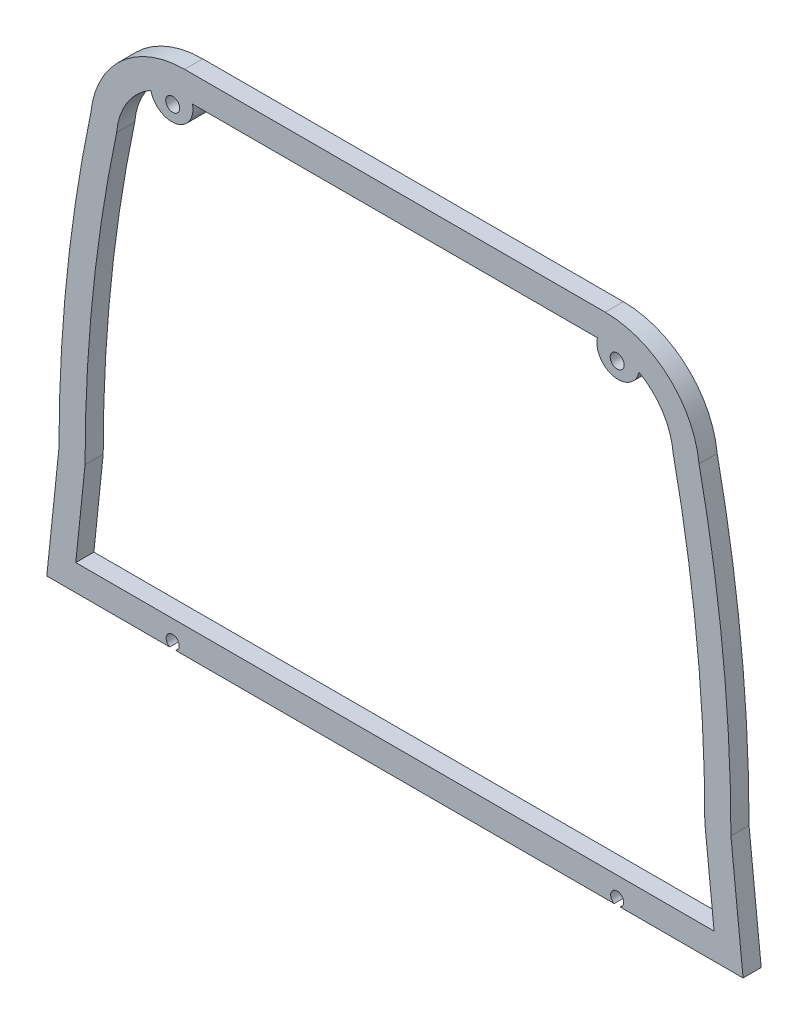
from build123d import *

# Parameters (mm, degrees)
SKETCH1_R           = 0.6096
BOSS_EXTRUDE1_DEPTH = 1.5875


with BuildPart() as part:
    # Sketch1 → Boss-Extrude1 (new body)
    with BuildSketch(Plane.XY):
        with BuildLine():
            Line((30.48, -22.225), (29.415104476, -11.9888))
            ThreePointArc((29.415104476, -11.9888), (28.715873825, 1.490040556), (26.625688573, 14.824176893))
            ThreePointArc((26.625688573, 14.824176893), (23.941924767, 20.101731209), (18.415, 22.225))
            Line((18.415, 22.225), (-18.415, 22.225))
            ThreePointArc((-18.415, 22.225), (-23.941924767, 20.101731209), (-26.625688573, 14.824176893))
            ThreePointArc((-26.625688573, 14.824176893), (-28.715873825, 1.490040556), (-29.415104476, -11.9888))
            Line((-29.415104476, -11.9888), (-30.48, -22.225))
            Line((-30.48, -22.225), (-19.719346062, -22.225))
            ThreePointArc((-19.719346062, -22.225), (-19.457528855, -21.1455), (-19.195711648, -22.225))
            Line((-19.195711648, -22.225), (19.195711648, -22.225))
            ThreePointArc((19.195711648, -22.225), (19.457528855, -21.1455), (19.719346062, -22.225))
            Line((19.719346062, -22.225), (30.48, -22.225))
        make_face()
        with BuildLine():
            Line((-17.725268352, 19.939), (17.725268352, 19.939))
            ThreePointArc((17.725268352, 19.939), (19.155271645, 17.728799653), (21.365471992, 19.158802947))
            ThreePointArc((21.365471992, 19.158802947), (23.441797038, 17.188737724), (24.362294321, 14.478577686))
            ThreePointArc((24.362294321, 14.478577686), (26.441646573, 1.258286409), (27.129050016, -12.106865432))
            Line((27.129050016, -12.106865432), (27.943845061, -19.939))
            Line((27.943845061, -19.939), (-27.943845061, -19.939))
            Line((-27.943845061, -19.939), (-27.129050016, -12.106865432))
            ThreePointArc((-27.129050016, -12.106865432), (-26.441646573, 1.258286409), (-24.362294321, 14.478577686))
            ThreePointArc((-24.362294321, 14.478577686), (-23.441797038, 17.188737724), (-21.365471992, 19.158802947))
            ThreePointArc((-21.365471992, 19.158802947), (-19.155271645, 17.728799653), (-17.725268352, 19.939))
        make_face(mode=Mode.SUBTRACT)
        with Locations((19.457528855, 19.05)):
            Circle(SKETCH1_R, mode=Mode.SUBTRACT)
        with Locations((-19.457528855, 19.05)):
            Circle(SKETCH1_R, mode=Mode.SUBTRACT)
    extrude(amount=BOSS_EXTRUDE1_DEPTH)


solid = part.part
